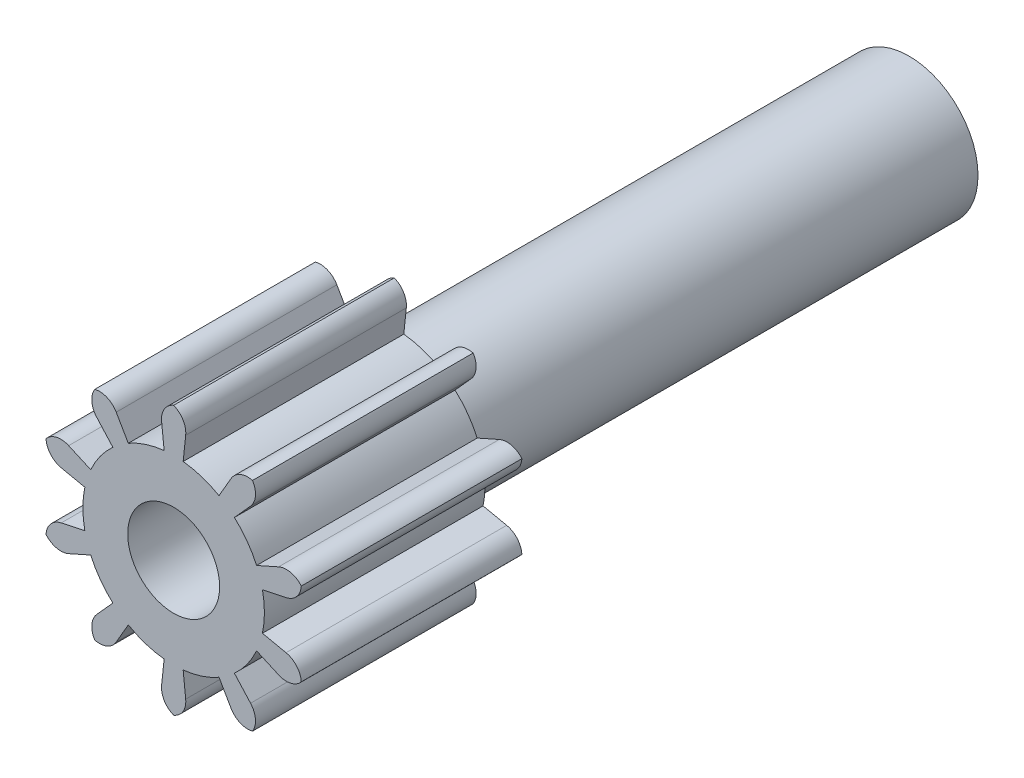
from build123d import *

# Parameters (mm, degrees)
SKETCH1_R           = 0.75
BOSS_EXTRUDE1_DEPTH = 2.4
BOSS_EXTRUDE2_START = -8
SKETCH2_R           = 0.75
SKETCH2_R_2         = 0.5
BOSS_EXTRUDE2_DEPTH = 8


with BuildPart() as part:
    # Sketch1 → Boss-Extrude1 (new body)
    with BuildSketch(Plane.XY):
        with BuildLine():
            Line((-0.103544507, 0.982056406), (-0.131068996, 1.243109375))
            ThreePointArc((-0.131068996, 1.243109375), (-0.10199222, 1.373586424), (0, 1.46))
            ThreePointArc((0, 1.46), (0.10199222, 1.373586424), (0.131068996, 1.243109375))
            Line((0.131068996, 1.243109375), (0.103544507, 0.982056406))
            ThreePointArc((0.103544507, 0.982056406), (0.305154282, 0.93916831), (0.493469007, 0.855362256))
            Line((0.493469007, 0.855362256), (0.624644312, 1.082737033))
            ThreePointArc((0.624644312, 1.082737033), (0.724860403, 1.171204283), (0.858166468, 1.181164812))
            ThreePointArc((0.858166468, 1.181164812), (0.889887282, 1.051305237), (0.836718403, 0.928656187))
            Line((0.836718403, 0.928656187), (0.661007538, 0.733638388))
            ThreePointArc((0.661007538, 0.733638388), (0.798904282, 0.580437937), (0.901994132, 0.401948797))
            Line((0.901994132, 0.401948797), (1.141764724, 0.508795946))
            ThreePointArc((1.141764724, 0.508795946), (1.27484099, 0.521461914), (1.388542514, 0.451164812))
            ThreePointArc((1.388542514, 0.451164812), (1.337875649, 0.327461182), (1.222769819, 0.2594879))
            Line((1.222769819, 0.2594879), (0.965988157, 0.204995441))
            ThreePointArc((0.965988157, 0.204995441), (0.9875, 0), (0.965988157, -0.204995441))
            Line((0.965988157, -0.204995441), (1.222769819, -0.2594879))
            ThreePointArc((1.222769819, -0.2594879), (1.337875649, -0.327461182), (1.388542514, -0.451164812))
            ThreePointArc((1.388542514, -0.451164812), (1.27484099, -0.521461914), (1.141764724, -0.508795946))
            Line((1.141764724, -0.508795946), (0.901994132, -0.401948797))
            ThreePointArc((0.901994132, -0.401948797), (0.798904282, -0.580437937), (0.661007538, -0.733638388))
            Line((0.661007538, -0.733638388), (0.836718403, -0.928656187))
            ThreePointArc((0.836718403, -0.928656187), (0.889887282, -1.051305237), (0.858166468, -1.181164812))
            ThreePointArc((0.858166468, -1.181164812), (0.724860403, -1.171204283), (0.624644312, -1.082737033))
            Line((0.624644312, -1.082737033), (0.493469007, -0.855362256))
            ThreePointArc((0.493469007, -0.855362256), (0.305154282, -0.93916831), (0.103544507, -0.982056406))
            Line((0.103544507, -0.982056406), (0.131068996, -1.243109375))
            ThreePointArc((0.131068996, -1.243109375), (0.10199222, -1.373586424), (0, -1.46))
            ThreePointArc((0, -1.46), (-0.10199222, -1.373586424), (-0.131068996, -1.243109375))
            Line((-0.131068996, -1.243109375), (-0.103544507, -0.982056406))
            ThreePointArc((-0.103544507, -0.982056406), (-0.305154282, -0.93916831), (-0.493469007, -0.855362256))
            Line((-0.493469007, -0.855362256), (-0.624644312, -1.082737033))
            ThreePointArc((-0.624644312, -1.082737033), (-0.724860403, -1.171204283), (-0.858166468, -1.181164812))
            ThreePointArc((-0.858166468, -1.181164812), (-0.889887282, -1.051305237), (-0.836718403, -0.928656187))
            Line((-0.836718403, -0.928656187), (-0.661007538, -0.733638388))
            ThreePointArc((-0.661007538, -0.733638388), (-0.798904282, -0.580437937), (-0.901994132, -0.401948797))
            Line((-0.901994132, -0.401948797), (-1.141764724, -0.508795946))
            ThreePointArc((-1.141764724, -0.508795946), (-1.27484099, -0.521461914), (-1.388542514, -0.451164812))
            ThreePointArc((-1.388542514, -0.451164812), (-1.337875649, -0.327461182), (-1.222769819, -0.2594879))
            Line((-1.222769819, -0.2594879), (-0.965988157, -0.204995441))
            ThreePointArc((-0.965988157, -0.204995441), (-0.9875, 0), (-0.965988157, 0.204995441))
            Line((-0.965988157, 0.204995441), (-1.222769819, 0.2594879))
            ThreePointArc((-1.222769819, 0.2594879), (-1.337875649, 0.327461182), (-1.388542514, 0.451164812))
            ThreePointArc((-1.388542514, 0.451164812), (-1.27484099, 0.521461914), (-1.141764724, 0.508795946))
            Line((-1.141764724, 0.508795946), (-0.901994132, 0.401948797))
            ThreePointArc((-0.901994132, 0.401948797), (-0.798904282, 0.580437937), (-0.661007538, 0.733638388))
            Line((-0.661007538, 0.733638388), (-0.836718403, 0.928656187))
            ThreePointArc((-0.836718403, 0.928656187), (-0.889887282, 1.051305237), (-0.858166468, 1.181164812))
            ThreePointArc((-0.858166468, 1.181164812), (-0.724860403, 1.171204283), (-0.624644312, 1.082737033))
            Line((-0.624644312, 1.082737033), (-0.493469007, 0.855362256))
            ThreePointArc((-0.493469007, 0.855362256), (-0.305154282, 0.93916831), (-0.103544507, 0.982056406))
        make_face()
        Circle(SKETCH1_R, mode=Mode.SUBTRACT)
    extrude(amount=BOSS_EXTRUDE1_DEPTH)

    # Sketch2 → Boss-Extrude2 (add)
    with BuildSketch(Plane.XY.offset(2.4).offset(BOSS_EXTRUDE2_START)):
        Circle(SKETCH2_R)
        Circle(SKETCH2_R_2, mode=Mode.SUBTRACT)
    extrude(amount=BOSS_EXTRUDE2_DEPTH)


solid = part.part
